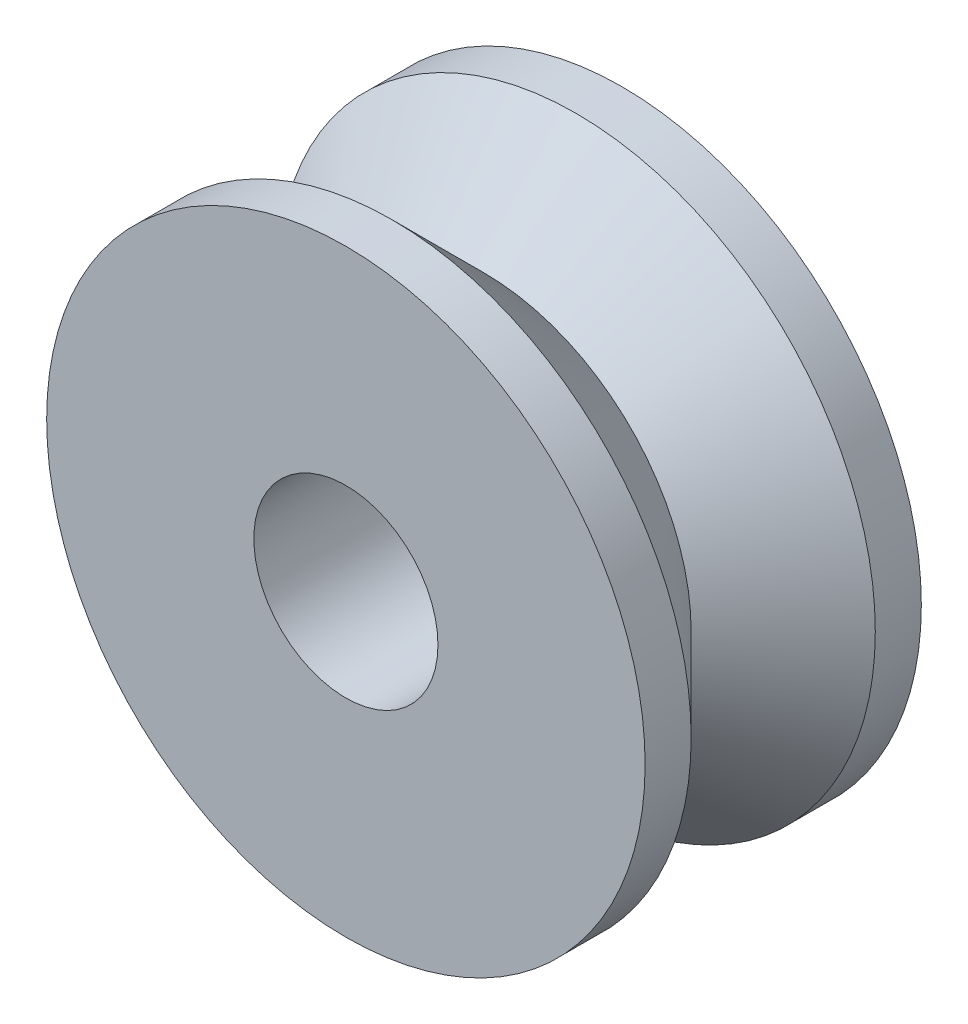
from build123d import *

# Parameters (mm, degrees)
F_4_0_4_DIAMETER_HOLE1_D = 4


with BuildPart() as part:
    # Sketch1 → Revolve1 (revolve)
    with BuildSketch(Plane(origin=(0, 0, 0), x_dir=(0, 0, -1), z_dir=(1, 0, 0)), mode=Mode.PRIVATE) as revolve1_sk:
        Polygon((0, 0), (0, 6.5), (-1, 6.5), (-3, 4.5), (-5, 6.5), (-6, 6.5), (-6, 0), align=None)
    revolve(revolve1_sk.sketch.rotate(Axis((0, 0, 55), (0, 0, -1)), 90), axis=Axis((0, 0, 55), (0, 0, -1)))

    # Ø4.0 (4) Diameter Hole1 (through all)
    with Locations(Plane.XY.offset(6)):
        with Locations((0, 0)):
            Hole(F_4_0_4_DIAMETER_HOLE1_D / 2)


solid = part.part
